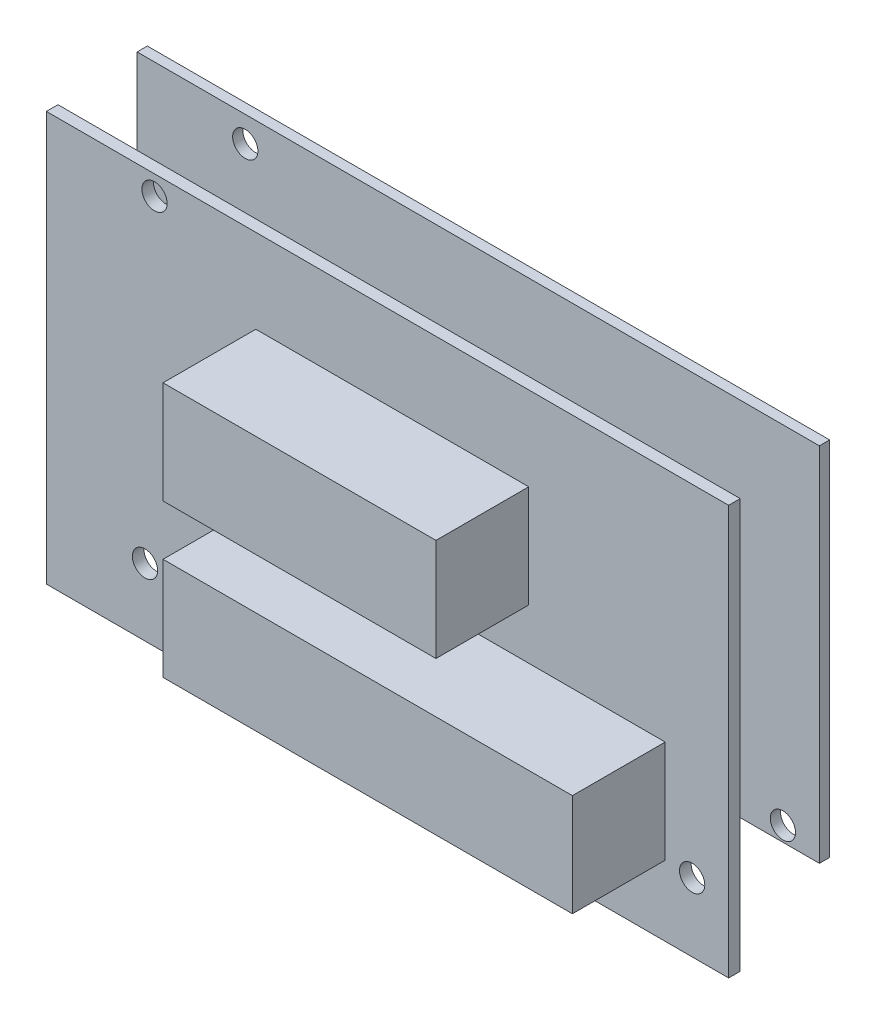
from build123d import *

# Parameters (mm, degrees)
ESBO_O1_W                = 100
ESBO_O1_H                = 60
ESBO_O1_R                = 1.85
RESSALTO_EXTRUS_O1_DEPTH = 1.7
ESBO_O2_W                = 60
ESBO_O2_H                = 15
ESBO_O2_W_2              = 40
RESSALTO_EXTRUS_O2_DEPTH = 13.6
RESSALTO_EXTRUS_O6_START = 11.6
ESBO_O3_W                = 100
ESBO_O3_H                = 53
ESBO_O3_R                = 1.85
RESSALTO_EXTRUS_O6_DEPTH = 1.5


with BuildPart() as part:
    # Esboço1 → Ressalto-extrusão1 (new body)
    with BuildSketch(Plane.XY):
        Rectangle(ESBO_O1_W, ESBO_O1_H)
        with Locations((-34.15, 27.15)):
            Circle(ESBO_O1_R, mode=Mode.SUBTRACT)
        with Locations((-35.55, -20.15)):
            Circle(ESBO_O1_R, mode=Mode.SUBTRACT)
        with Locations((44.65, -19.95)):
            Circle(ESBO_O1_R, mode=Mode.SUBTRACT)
    extrude(amount=RESSALTO_EXTRUS_O1_DEPTH)

    # Esboço2 → Ressalto-extrusão2 (add)
    with BuildSketch(Plane.XY.offset(1.7)):
        with Locations((10.7, -12.2)):
            Rectangle(ESBO_O2_W, ESBO_O2_H)
        with Locations((0.7, 10.2)):
            Rectangle(ESBO_O2_W_2, ESBO_O2_H)
    extrude(amount=RESSALTO_EXTRUS_O2_DEPTH)


with BuildPart() as body_2:
    # Esboço3 → Ressalto-extrusão6 (new body)
    with BuildSketch(Plane(origin=(0, 0, 0), x_dir=(-1, 0, 0), z_dir=(0, 0, -1)).offset(RESSALTO_EXTRUS_O6_START)):
        with Locations((0, 4.4)):
            Rectangle(ESBO_O3_W, ESBO_O3_H)
        with Locations((-44.65, -19.95)):
            Circle(ESBO_O3_R, mode=Mode.SUBTRACT)
        with Locations((34.15, 27.15)):
            Circle(ESBO_O3_R, mode=Mode.SUBTRACT)
        with Locations((35.55, -20.15)):
            Circle(ESBO_O3_R, mode=Mode.SUBTRACT)
    extrude(amount=RESSALTO_EXTRUS_O6_DEPTH)


solid = Compound([part.part, body_2.part])
